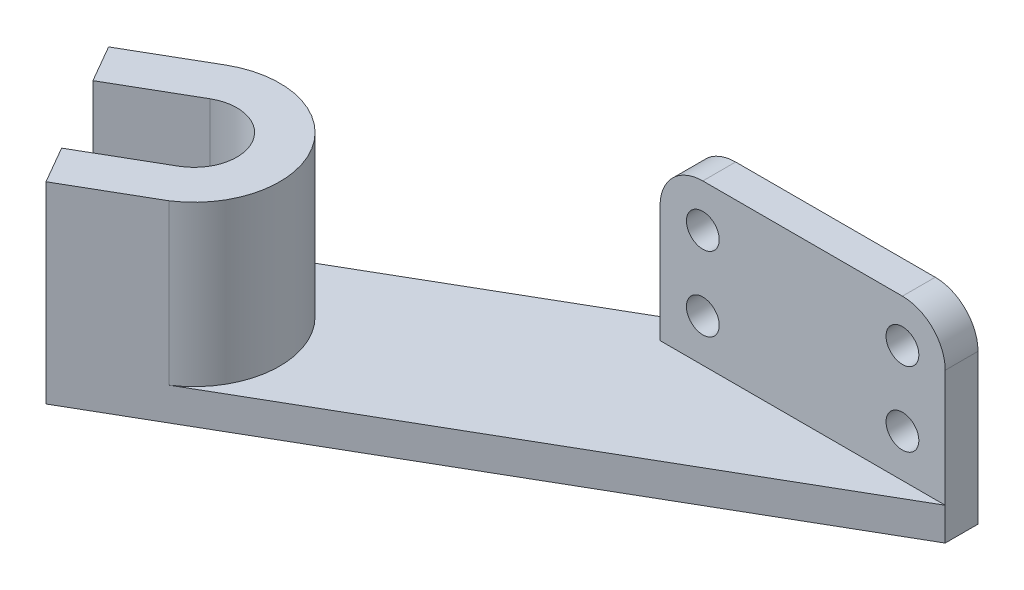
from build123d import *

# Parameters (mm, degrees)
SKETCH_1_W                = 100
SKETCH_1_H                = 67.5
EXTRUDE_1_DEPTH           = 5.75
FILLET_1_R                = 15
HOLE_WIZARD_11_5_11_5_1_D = 11.5
EXTRUDE_2_DEPTH           = 11.5
EXTRUDE_3_DEPTH           = 56


with BuildPart() as part:
    # 草图1 → 凸台-拉伸1 (new, symmetric)
    with BuildSketch(Plane.XY):
        Rectangle(SKETCH_1_W, SKETCH_1_H)
    extrude(amount=EXTRUDE_1_DEPTH, both=True)

    # 圆角1
    fillet_1_edges = [part.edges().sort_by_distance(p)[0] for p in [
        (-50, 33.75, 0),
        (50, 33.75, 0),
    ]]
    fillet(fillet_1_edges, radius=FILLET_1_R)

    # Ø11.5 (11.5) 直径孔1 (through all)
    with Locations(Plane.XY.offset(5.75)):
        with Locations((-35, 18.75), (35, 18.75), (-35, -7.25), (35, -7.25)):
            Hole(HOLE_WIZARD_11_5_11_5_1_D / 2)

    # 草图5 → 凸台-拉伸2 (add)
    with BuildSketch(Plane.XZ.offset(33.75)):
        with BuildLine():
            Line((-179.903810568, 69.25), (-50, -5.75))
            Line((-50, -5.75), (-50, 5.75))
            Line((-50, 5.75), (50, 5.75))
            Line((50, 5.75), (-149.924164496, 121.176270189))
            Line((-149.924164496, 121.176270189), (-157.403810568, 108.22114317))
            Line((-157.403810568, 108.22114317), (-131.423048454, 93.22114317))
            ThreePointArc((-131.423048454, 93.22114317), (-125.932667397, 72.730762114), (-146.423048454, 67.240381057))
            Line((-146.423048454, 67.240381057), (-172.403810568, 82.240381057))
            Line((-172.403810568, 82.240381057), (-179.903810568, 69.25))
        make_face()
    extrude(amount=-EXTRUDE_2_DEPTH)

    # 草图6 → 凸台-拉伸3 (add)
    with BuildSketch(Plane(origin=(0, -22.25, 0), x_dir=(1, 0, 0), z_dir=(0, 1, 0))):
        with BuildLine():
            Line((-125.296403009, -106.957425465), (-122.590401756, -105.395114913))
            ThreePointArc((-122.590401756, -105.395114913), (-113.341811547, -64.559121538), (-153.923048454, -54.25))
            Line((-153.923048454, -54.25), (-179.903810568, -69.25))
            Line((-179.903810568, -69.25), (-172.403810568, -82.240381057))
            Line((-172.403810568, -82.240381057), (-146.423048454, -67.240381057))
            ThreePointArc((-146.423048454, -67.240381057), (-125.932667397, -72.730762114), (-131.423048454, -93.22114317))
            Line((-131.423048454, -93.22114317), (-157.403810568, -108.22114317))
            Line((-157.403810568, -108.22114317), (-149.924164496, -121.176270189))
            Line((-149.924164496, -121.176270189), (-125.296403009, -106.957425465))
        make_face()
    extrude(amount=EXTRUDE_3_DEPTH)


solid = part.part
